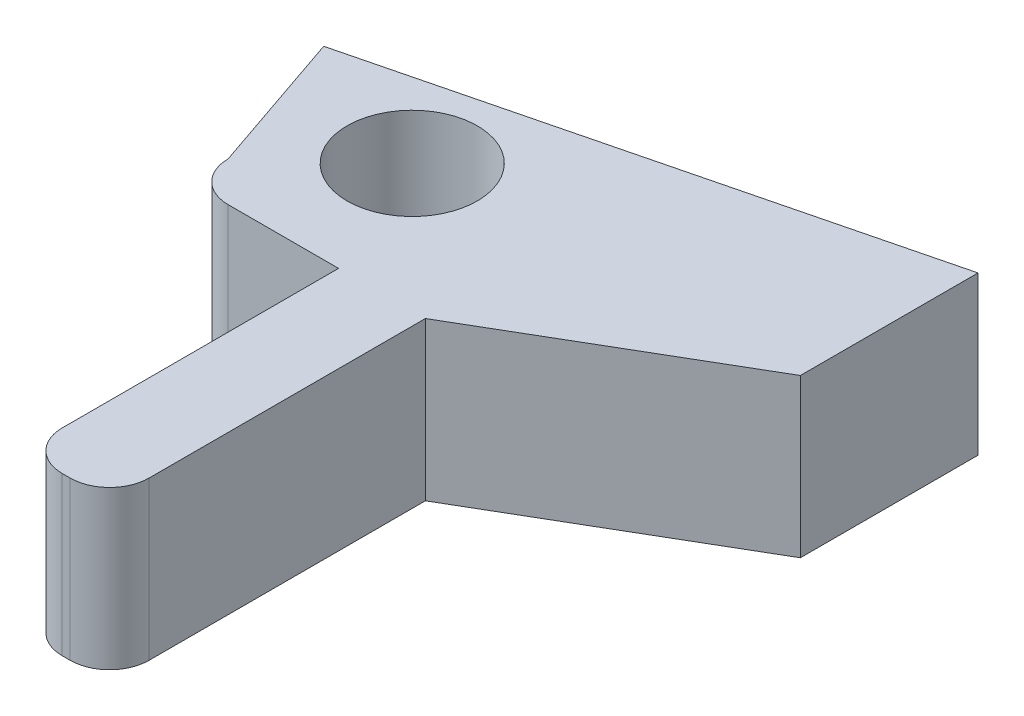
from build123d import *

# Parameters (mm, degrees)
SKETCH1_R           = 1.65
BOSS_EXTRUDE1_DEPTH = 4
SKETCH2_W           = 2.2
SKETCH2_H           = 8
BOSS_EXTRUDE2_DEPTH = 4
FILLET1_R           = 1
FILLET2_R           = 1
BOSS_EXTRUDE3_DEPTH = 4


with BuildPart() as part:
    # Sketch1 → Boss-Extrude1 (new body)
    with BuildSketch(Plane(origin=(0, 0, 0), x_dir=(1, 0, 0), z_dir=(0, 1, 0))):
        Polygon((4.781972019, 3), (-7.218027981, 0), (-7.218027981, -5), (-1.218027981, -5), (4.781972019, -1.5), (4.781972019, 0), align=None)
        with Locations(Location((-4.78871413, -1.763457272, 0), (0, 0, 270))):
            Circle(SKETCH1_R, mode=Mode.SUBTRACT)
    extrude(amount=BOSS_EXTRUDE1_DEPTH)

    # Sketch2 → Boss-Extrude2 (add)
    with BuildSketch(Plane(origin=(0, 4, 0), x_dir=(1, 0, 0), z_dir=(0, 1, 0))):
        with Locations((-2.318027981, -9)):
            Rectangle(SKETCH2_W, SKETCH2_H)
    extrude(amount=-BOSS_EXTRUDE2_DEPTH)

    # Fillet1
    fillet1_edges = [part.edges().sort_by_distance(p)[0] for p in [
        (-1.218027981, 2, 13),
        (-3.418027981, 2, 13),
    ]]
    fillet(fillet1_edges, radius=FILLET1_R)

    # Fillet2
    fillet2_edges = [part.edges().sort_by_distance(p)[0] for p in [
        (-7.218027981, 2, 5),
    ]]
    fillet(fillet2_edges, radius=FILLET2_R)

    # Sketch3 → Boss-Extrude3 (add)
    with BuildSketch(Plane(origin=(0, 4, 0), x_dir=(1, 0, 0), z_dir=(0, 1, 0))):
        Polygon((-7.218027981, 0), (-8.479213231, -0.315296313), (-7.218027981, -4), align=None)
    extrude(amount=-BOSS_EXTRUDE3_DEPTH)


solid = part.part
